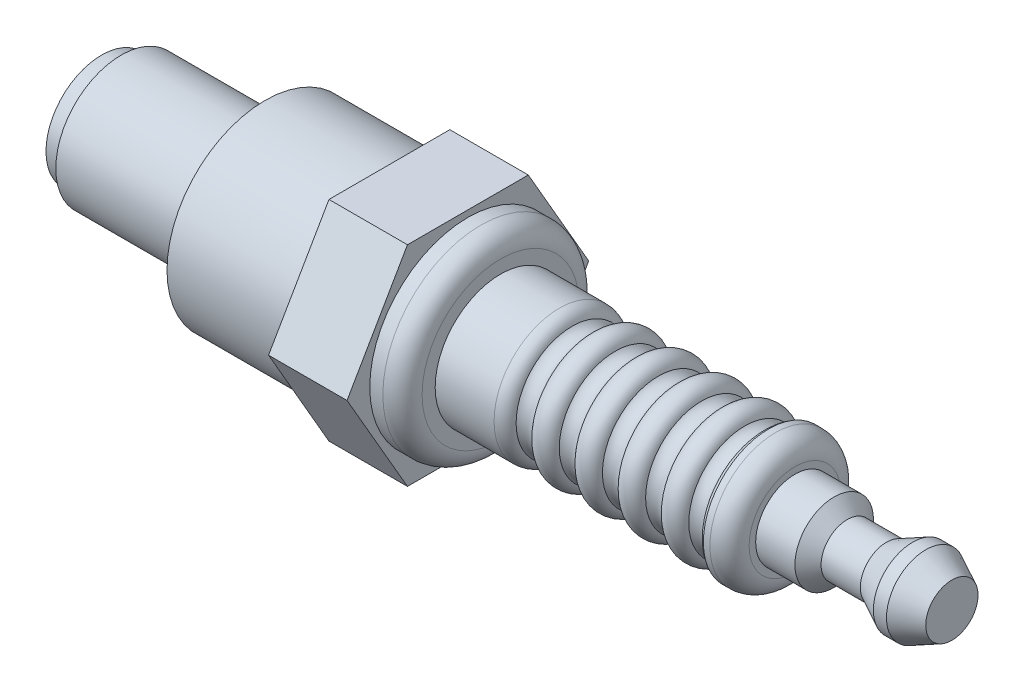
from build123d import *

# Parameters (mm, degrees)
BOSS_EXTRU_1_DEPTH = 6


with BuildPart() as part:
    # Esquisse1 → Base-Révolution (revolve)
    with BuildSketch(Plane.XY, mode=Mode.PRIVATE) as base_r_volution_sk:
        with BuildLine():
            Line((0, 0), (0, 4.25))
            Line((0, 4.25), (1.5, 4.25))
            Line((1.5, 4.25), (1.5, 5))
            Line((1.5, 5), (12.5, 5))
            Line((12.5, 5), (12.5, 7.5))
            Line((12.5, 7.5), (29, 7.5))
            ThreePointArc((29, 7.5), (30.060660172, 7.060660172), (30.5, 6))
            Line((30.5, 6), (30.5, 5))
            Line((30.5, 5), (35.294011105, 5))
            Line((35.294011105, 5), (51.5, 5))
            ThreePointArc((51.5, 5), (52.560660172, 4.560660172), (53, 3.5))
            Line((53, 3.5), (53, 3))
            Line((53, 3), (65, 3))
            Line((65, 3), (65, 0))
            Line((65, 0), (0, 0))
        make_face()
    revolve(base_r_volution_sk.sketch.rotate(Axis((-10, 0, 0), (1, 0, 0)), 90), axis=Axis((-10, 0, 0), (1, 0, 0)))

    # Esquisse2 → Enlèvement de matière-Révolution1 (revolve, cut)
    with BuildSketch(Plane.XY, mode=Mode.PRIVATE) as enl_vement_de_mati_re_r_volution1_sk:
        Polygon((60, 2), (62, 3), (63, 3), (65, 2), (65, 4), (60, 4), (57, 4), (56, 3), (57, 2), align=None)
        with BuildLine():
            Line((35, 5), (34, 5))
            Line((34, 5), (34, 6))
            Line((34, 6), (51, 6))
            Line((51, 6), (51, 5))
            ThreePointArc((51, 5), (50.593748432, 4.654758044), (50.393565671, 4.160633357))
            ThreePointArc((50.393565671, 4.160633357), (49.757772717, 4.004262018), (49.161516186, 4.274748294))
            ThreePointArc((49.161516186, 4.274748294), (48.2, 5), (47.238483814, 4.274748294))
            ThreePointArc((47.238483814, 4.274748294), (46.55, 4), (45.861516186, 4.274748294))
            ThreePointArc((45.861516186, 4.274748294), (44.9, 5), (43.938483814, 4.274748294))
            ThreePointArc((43.938483814, 4.274748294), (43.25, 4), (42.561516186, 4.274748294))
            ThreePointArc((42.561516186, 4.274748294), (41.6, 5), (40.638483814, 4.274748294))
            ThreePointArc((40.638483814, 4.274748294), (39.95, 4), (39.261516186, 4.274748294))
            ThreePointArc((39.261516186, 4.274748294), (38.3, 5), (37.338483814, 4.274748294))
            ThreePointArc((37.338483814, 4.274748294), (36.65, 4), (35.961516186, 4.274748294))
            ThreePointArc((35.961516186, 4.274748294), (35.602184235, 4.798357155), (35, 5))
        make_face()
    revolve(enl_vement_de_mati_re_r_volution1_sk.sketch.rotate(Axis((-7, 0, 0), (1, 0, 0)), 90), axis=Axis((-7, 0, 0), (1, 0, 0)), mode=Mode.SUBTRACT)

    # Esquisse3 → Boss.-Extru.1 (add)
    with BuildSketch(Plane(origin=(22, 0, 0), x_dir=(0, 0, -1), z_dir=(1, 0, 0))):
        Polygon((-4.618802154, 8), (4.618802154, 8), (9.237604307, 0), (4.618802154, -8), (-4.618802154, -8), (-9.237604307, 0), align=None)
    extrude(amount=BOSS_EXTRU_1_DEPTH)


solid = part.part
